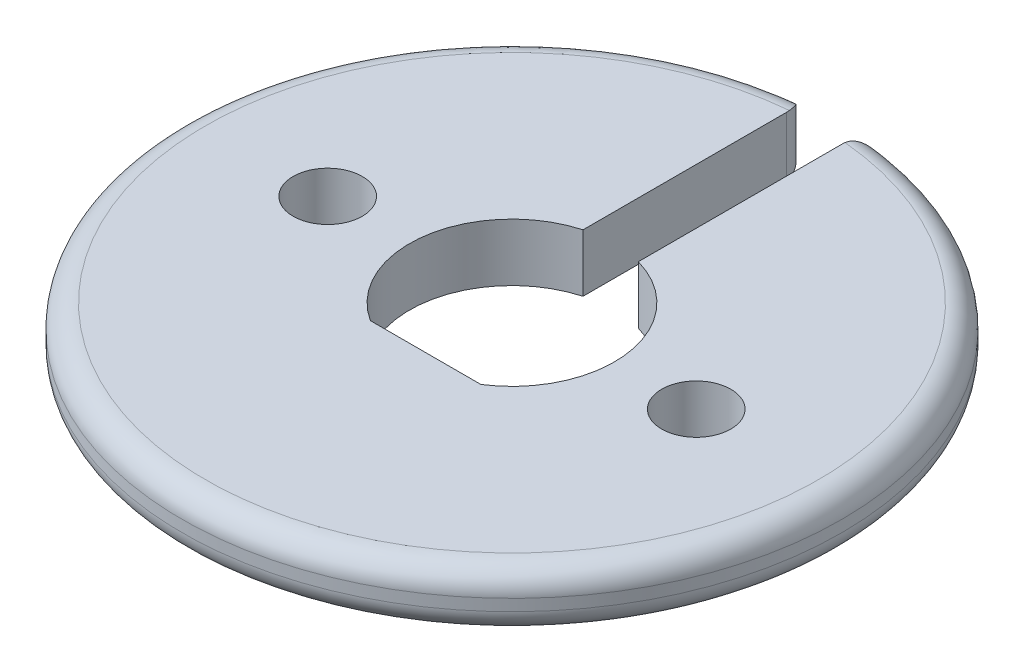
from build123d import *

# Parameters (mm, degrees)
SKETCH1_R           = 14.307679757
BOSS_EXTRUDE1_DEPTH = 2.5
CUT_EXTRUDE1_DEPTH  = 15
FILLET1_R           = 1
SKETCH6_R           = 1.5
CUT_EXTRUDE2_DEPTH  = 10


with BuildPart() as part:
    # Sketch1 → Boss-Extrude1 (new body)
    with BuildSketch(Plane(origin=(0, 0, 0), x_dir=(1, 0, 0), z_dir=(0, 1, 0))):
        Circle(SKETCH1_R)
        with BuildLine():
            Line((-2.4, -3.747332385), (2.4, -3.747332385))
            ThreePointArc((2.4, -3.747332385), (0, 4.45), (-2.4, -3.747332385))
        make_face(mode=Mode.SUBTRACT)
    extrude(amount=BOSS_EXTRUDE1_DEPTH)

    # Sketch4 → Cut-Extrude1 (cut)
    with BuildSketch(Plane.XZ):
        with BuildLine():
            Line((-1.2, -4.285148772), (-1.2, -14.257268323))
            ThreePointArc((-1.2, -14.257268323), (0, -14.307679757), (1.2, -14.257268323))
            Line((1.2, -14.257268323), (1.2, -4.285148772))
            ThreePointArc((1.2, -4.285148772), (0, -4.45), (-1.2, -4.285148772))
        make_face()
    extrude(amount=-CUT_EXTRUDE1_DEPTH, mode=Mode.SUBTRACT)

    # Fillet1
    fillet1_edges = [part.edges().sort_by_distance(p)[0] for p in [
        (-1.2, 1.25, -14.257268323),
        (0, 2.5, 14.307679757),
        (1.2, 1.25, -14.257268323),
        (0, 0, 14.307679757),
    ]]
    fillet(fillet1_edges, radius=FILLET1_R)

    # Sketch6 → Cut-Extrude2 (cut)
    with BuildSketch(Plane(origin=(0, 2.5, 0), x_dir=(1, 0, 0), z_dir=(0, 1, 0))):
        with Locations((8, 0)):
            Circle(SKETCH6_R)
        with Locations((-8, 0)):
            Circle(SKETCH6_R)
    extrude(amount=-CUT_EXTRUDE2_DEPTH, mode=Mode.SUBTRACT)


solid = part.part
